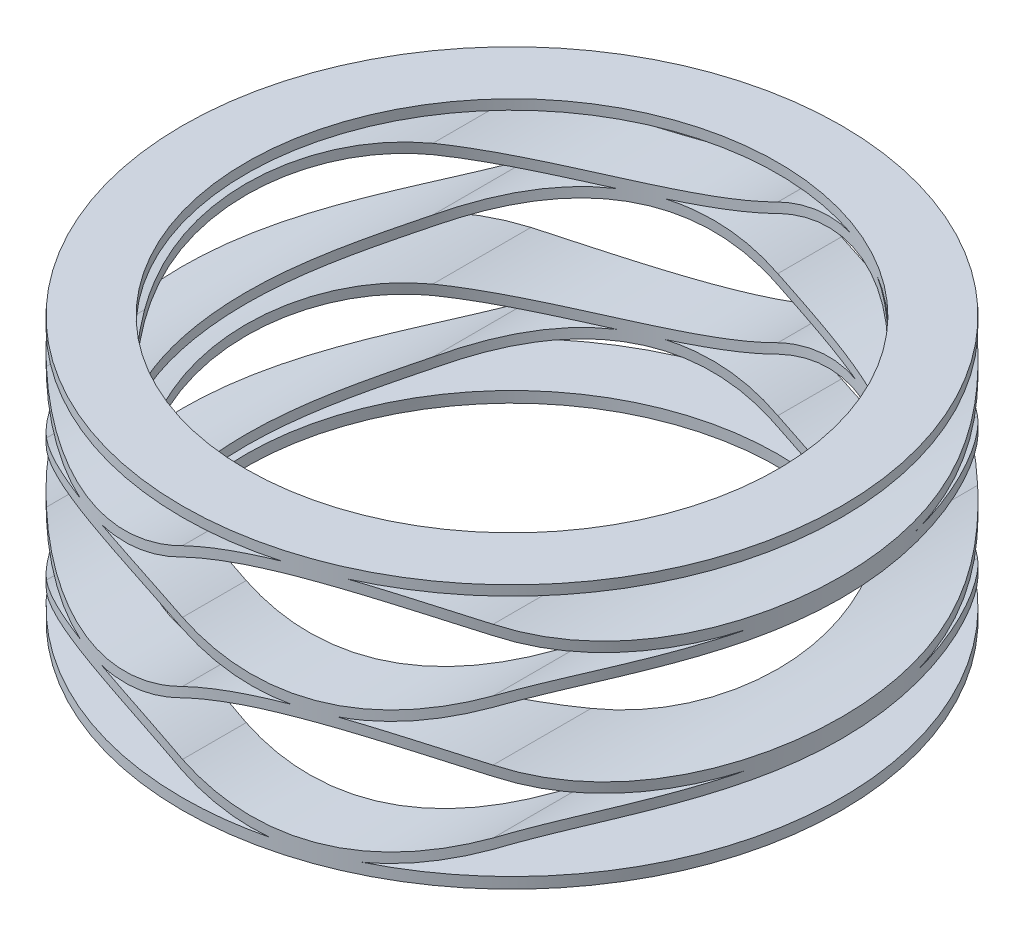
from build123d import *

# Parameters (mm, degrees)
SKETCH1_W           = 30.988
SKETCH1_H           = 30.988
EXTRUDE1_DEPTH      = 0.254
EXTRUDE2_DEPTH      = 9.45134
EXTRUDE2_DEPTH_BACK = 9.45134
EXTRUDE3_DEPTH      = 9.2964
EXTRUDE3_DEPTH_BACK = 9.2964
EXTRUDE4_DEPTH      = 9.2964
EXTRUDE4_DEPTH_BACK = 9.2964
EXTRUDE5_DEPTH      = 9.2964
EXTRUDE5_DEPTH_BACK = 9.2964
SKETCH6_W           = 30.988
SKETCH6_H           = 30.988
EXTRUDE6_DEPTH      = 0.2286
SKETCH7_W           = 30.988
SKETCH7_H           = 30.988
SKETCH7_R           = 7.62
EXTRUDE7_DEPTH      = 6.096
SKETCH8_R           = 6.1468
EXTRUDE8_DEPTH      = 6.096


with BuildPart() as part:
    # Sketch1 → Extrude1 (new body)
    with BuildSketch(Plane(origin=(0, 0, 0), x_dir=(-1, 0, 0), z_dir=(0, 1, 0))):
        Rectangle(SKETCH1_W, SKETCH1_H)
    extrude(amount=EXTRUDE1_DEPTH)

    # Sketch2 → Extrude2 (add, two sides: drawn at the far end of the back side and taken through both)
    with BuildSketch(Plane.XY.offset(-EXTRUDE2_DEPTH_BACK)):
        with BuildLine():
            Line((10.329333333, 0.79375), (10.329333333, 1.02235))
            ThreePointArc((10.329333333, 1.02235), (7.747, 1.6637), (5.164666667, 1.02235))
            ThreePointArc((5.164666667, 1.02235), (2.582333333, 0.4318), (0, 1.02235))
            ThreePointArc((0, 1.02235), (-2.582333333, 1.6637), (-5.164666667, 1.02235))
            ThreePointArc((-5.164666667, 1.02235), (-7.747, 0.4318), (-10.329333333, 1.02235))
            Line((-10.329333333, 1.02235), (-10.329333333, 0.79375))
            ThreePointArc((-10.329333333, 0.79375), (-7.747, 0.2032), (-5.164666667, 0.79375))
            ThreePointArc((-5.164666667, 0.79375), (-2.582333333, 1.4351), (0, 0.79375))
            ThreePointArc((0, 0.79375), (2.582333333, 0.2032), (5.164666667, 0.79375))
            ThreePointArc((5.164666667, 0.79375), (7.747, 1.4351), (10.329333333, 0.79375))
        make_face()
    extrude(amount=EXTRUDE2_DEPTH + EXTRUDE2_DEPTH_BACK)

    # Sketch3 → Extrude3 (add, two sides: drawn at the far end of the back side and taken through both)
    with BuildSketch(Plane.XY.offset(-EXTRUDE3_DEPTH_BACK)):
        with BuildLine():
            Line((-10.329333333, 2.48285), (-10.329333333, 2.25425))
            ThreePointArc((-10.329333333, 2.25425), (-7.747, 2.8448), (-5.164666667, 2.25425))
            ThreePointArc((-5.164666667, 2.25425), (-2.582333333, 1.6383), (0, 2.25425))
            ThreePointArc((0, 2.25425), (2.582333333, 2.8448), (5.164666667, 2.25425))
            ThreePointArc((5.164666667, 2.25425), (7.747, 1.6383), (10.329333333, 2.25425))
            Line((10.329333333, 2.25425), (10.329333333, 2.48285))
            ThreePointArc((10.329333333, 2.48285), (7.747, 1.8669), (5.164666667, 2.48285))
            ThreePointArc((5.164666667, 2.48285), (2.582333333, 3.0734), (0, 2.48285))
            ThreePointArc((0, 2.48285), (-2.582333333, 1.8669), (-5.164666667, 2.48285))
            ThreePointArc((-5.164666667, 2.48285), (-7.747, 3.0734), (-10.329333333, 2.48285))
        make_face()
    extrude(amount=EXTRUDE3_DEPTH + EXTRUDE3_DEPTH_BACK)

    # Sketch4 → Extrude4 (add, two sides: drawn at the far end of the back side and taken through both)
    with BuildSketch(Plane.XY.offset(-EXTRUDE4_DEPTH_BACK)):
        with BuildLine():
            Line((10.329333333, 3.63855), (10.329333333, 3.86715))
            ThreePointArc((10.329333333, 3.86715), (7.747, 4.4831), (5.164666667, 3.86715))
            ThreePointArc((5.164666667, 3.86715), (2.582333333, 3.2766), (0, 3.86715))
            ThreePointArc((0, 3.86715), (-2.582333333, 4.4831), (-5.164666667, 3.86715))
            ThreePointArc((-5.164666667, 3.86715), (-7.747, 3.2766), (-10.329333333, 3.86715))
            Line((-10.329333333, 3.86715), (-10.329333333, 3.63855))
            ThreePointArc((-10.329333333, 3.63855), (-7.747, 3.048), (-5.164666667, 3.63855))
            ThreePointArc((-5.164666667, 3.63855), (-2.582333333, 4.2545), (0, 3.63855))
            ThreePointArc((0, 3.63855), (2.582333333, 3.048), (5.164666667, 3.63855))
            ThreePointArc((5.164666667, 3.63855), (7.747, 4.2545), (10.329333333, 3.63855))
        make_face()
    extrude(amount=EXTRUDE4_DEPTH + EXTRUDE4_DEPTH_BACK)

    # Sketch5 → Extrude5 (add, two sides: drawn at the far end of the back side and taken through both)
    with BuildSketch(Plane.XY.offset(-EXTRUDE5_DEPTH_BACK)):
        with BuildLine():
            Line((-10.329333333, 5.30225), (-10.329333333, 5.07365))
            ThreePointArc((-10.329333333, 5.07365), (-7.747, 5.6642), (-5.164666667, 5.07365))
            ThreePointArc((-5.164666667, 5.07365), (-2.582333333, 4.4577), (0, 5.07365))
            ThreePointArc((0, 5.07365), (2.582333333, 5.6642), (5.164666667, 5.07365))
            ThreePointArc((5.164666667, 5.07365), (7.747, 4.4577), (10.329333333, 5.07365))
            Line((10.329333333, 5.07365), (10.329333333, 5.30225))
            ThreePointArc((10.329333333, 5.30225), (7.747, 4.6863), (5.164666667, 5.30225))
            ThreePointArc((5.164666667, 5.30225), (2.582333333, 5.8928), (0, 5.30225))
            ThreePointArc((0, 5.30225), (-2.582333333, 4.6863), (-5.164666667, 5.30225))
            ThreePointArc((-5.164666667, 5.30225), (-7.747, 5.8928), (-10.329333333, 5.30225))
        make_face()
    extrude(amount=EXTRUDE5_DEPTH + EXTRUDE5_DEPTH_BACK)

    # Sketch6 → Extrude6 (add)
    with BuildSketch(Plane(origin=(0, 5.8674, 0), x_dir=(-1, 0, 0), z_dir=(0, 1, 0))):
        Rectangle(SKETCH6_W, SKETCH6_H)
    extrude(amount=EXTRUDE6_DEPTH)

    # Sketch7 → Extrude7 (cut)
    with BuildSketch(Plane(origin=(0, 0, 0), x_dir=(-1, 0, 0), z_dir=(0, 1, 0))):
        Rectangle(SKETCH7_W, SKETCH7_H)
        with Locations(Location((0, 0, 0), (0, 0, 90))):
            Circle(SKETCH7_R, mode=Mode.SUBTRACT)
    extrude(amount=EXTRUDE7_DEPTH, mode=Mode.SUBTRACT)

    # Sketch8 → Extrude8 (cut)
    with BuildSketch(Plane(origin=(0, 0, 0), x_dir=(-1, 0, 0), z_dir=(0, 1, 0))):
        with Locations(Location((0, 0, 0), (0, 0, 90))):
            Circle(SKETCH8_R)
    extrude(amount=EXTRUDE8_DEPTH, mode=Mode.SUBTRACT)


solid = part.part
